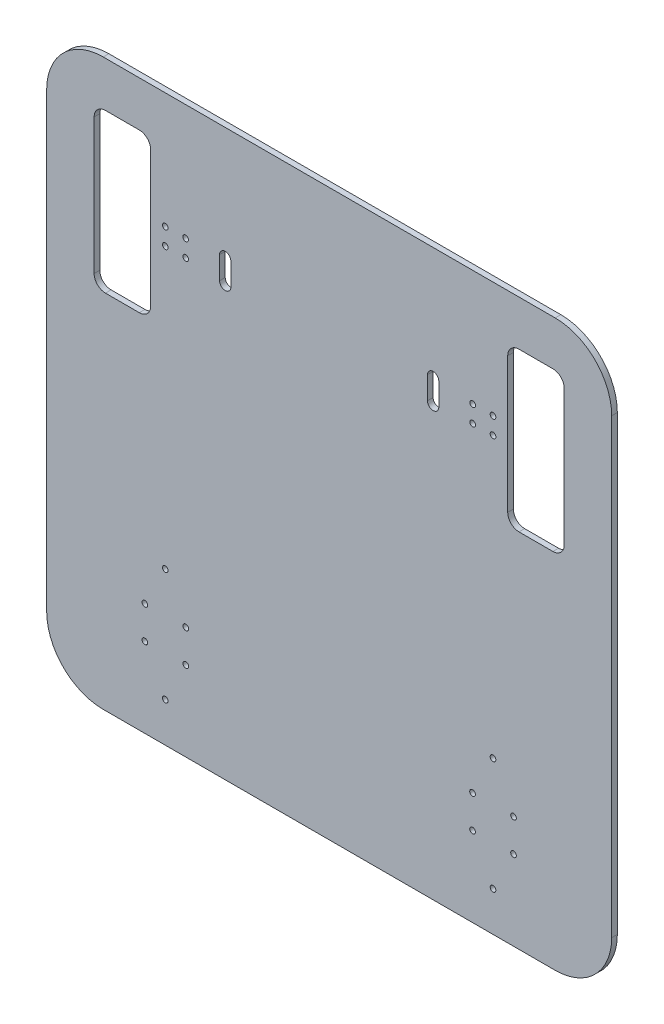
from build123d import *

# Parameters (mm, degrees)
SKETCH1_W           = 500
SKETCH1_H           = 500
SKETCH1_R           = 2.5
SKETCH1_W_2         = 50
SKETCH1_H_2         = 140
BOSS_EXTRUDE1_DEPTH = 5
CUT_EXTRUDE1_START  = -5
SKETCH2_R           = 2.5
CUT_EXTRUDE1_DEPTH  = 5
FILLET1_R           = 10
FILLET2_R           = 50
SKETCH3_W           = 10
SKETCH3_H           = 20
CUT_EXTRUDE2_DEPTH  = 354.588744165


with BuildPart() as part:
    # Sketch1 → Boss-Extrude1 (new body)
    with BuildSketch(Plane.XY):
        Rectangle(SKETCH1_W, SKETCH1_H)
        with Locations((127, 147.5)):
            Circle(SKETCH1_R, mode=Mode.SUBTRACT)
        with Locations((127, 132.5)):
            Circle(SKETCH1_R, mode=Mode.SUBTRACT)
        with Locations((145, 132.5)):
            Circle(SKETCH1_R, mode=Mode.SUBTRACT)
        with Locations((145, 147.5)):
            Circle(SKETCH1_R, mode=Mode.SUBTRACT)
        with Locations((-145, 147.5)):
            Circle(SKETCH1_R, mode=Mode.SUBTRACT)
        with Locations((-145, 132.5)):
            Circle(SKETCH1_R, mode=Mode.SUBTRACT)
        with Locations((-127, 132.5)):
            Circle(SKETCH1_R, mode=Mode.SUBTRACT)
        with Locations((-127, 147.5)):
            Circle(SKETCH1_R, mode=Mode.SUBTRACT)
        with Locations((183, 140)):
            Rectangle(SKETCH1_W_2, SKETCH1_H_2, mode=Mode.SUBTRACT)
        with Locations((-183, 140)):
            Rectangle(SKETCH1_W_2, SKETCH1_H_2, mode=Mode.SUBTRACT)
    extrude(amount=BOSS_EXTRUDE1_DEPTH)

    # Sketch2 → Cut-Extrude1 (cut)
    with BuildSketch(Plane.XY.offset(5).offset(CUT_EXTRUDE1_START)):
        with Locations((-145, 132.5)):
            Circle(SKETCH2_R)
        with Locations((-163.125, -150.6)):
            Circle(SKETCH2_R)
        with Locations((-126.875, -150.6)):
            Circle(SKETCH2_R)
        with Locations((-126.875, -179.4)):
            Circle(SKETCH2_R)
        with Locations((-163.125, -179.4)):
            Circle(SKETCH2_R)
        with Locations((-145, -115)):
            Circle(SKETCH2_R)
        with Locations((-145, -215)):
            Circle(SKETCH2_R)
        with Locations((145, -215)):
            Circle(SKETCH2_R)
        with Locations((145, -115)):
            Circle(SKETCH2_R)
        with Locations((163.125, -179.4)):
            Circle(SKETCH2_R)
        with Locations((126.875, -179.4)):
            Circle(SKETCH2_R)
        with Locations((126.875, -150.6)):
            Circle(SKETCH2_R)
        with Locations((163.125, -150.6)):
            Circle(SKETCH2_R)
    extrude(amount=CUT_EXTRUDE1_DEPTH, mode=Mode.SUBTRACT)

    # Fillet1
    fillet1_edges = [part.edges().sort_by_distance(p)[0] for p in [
        (-208, 70, 2.5),
        (-158, 70, 2.5),
        (-158, 210, 2.5),
        (-208, 210, 2.5),
        (158, 70, 2.5),
        (208, 70, 2.5),
        (208, 210, 2.5),
        (158, 210, 2.5),
    ]]
    fillet(fillet1_edges, radius=FILLET1_R)

    # Fillet2
    fillet2_edges = [part.edges().sort_by_distance(p)[0] for p in [
        (250, -250, 2.5),
        (-250, -250, 2.5),
        (-250, 250, 2.5),
        (250, 250, 2.5),
    ]]
    fillet(fillet2_edges, radius=FILLET2_R)

    # Sketch3 → Cut-Extrude2 (cut, through all)
    with BuildSketch(Plane.XY.offset(5)):
        with Locations((-92, 140)):
            Rectangle(SKETCH3_W, SKETCH3_H)
        with BuildLine():
            ThreePointArc((-97, 150), (-92, 155), (-87, 150))
            Line((-87, 150), (-97, 150))
        make_face()
        with BuildLine():
            Line((-97, 130), (-87, 130))
            ThreePointArc((-87, 130), (-92, 125), (-97, 130))
        make_face()
        with BuildLine():
            ThreePointArc((97, 130), (92, 125), (87, 130))
            Line((87, 130), (87, 150))
            ThreePointArc((87, 150), (92, 155), (97, 150))
            Line((97, 150), (97, 130))
        make_face()
    extrude(amount=-CUT_EXTRUDE2_DEPTH, mode=Mode.SUBTRACT)


solid = part.part
